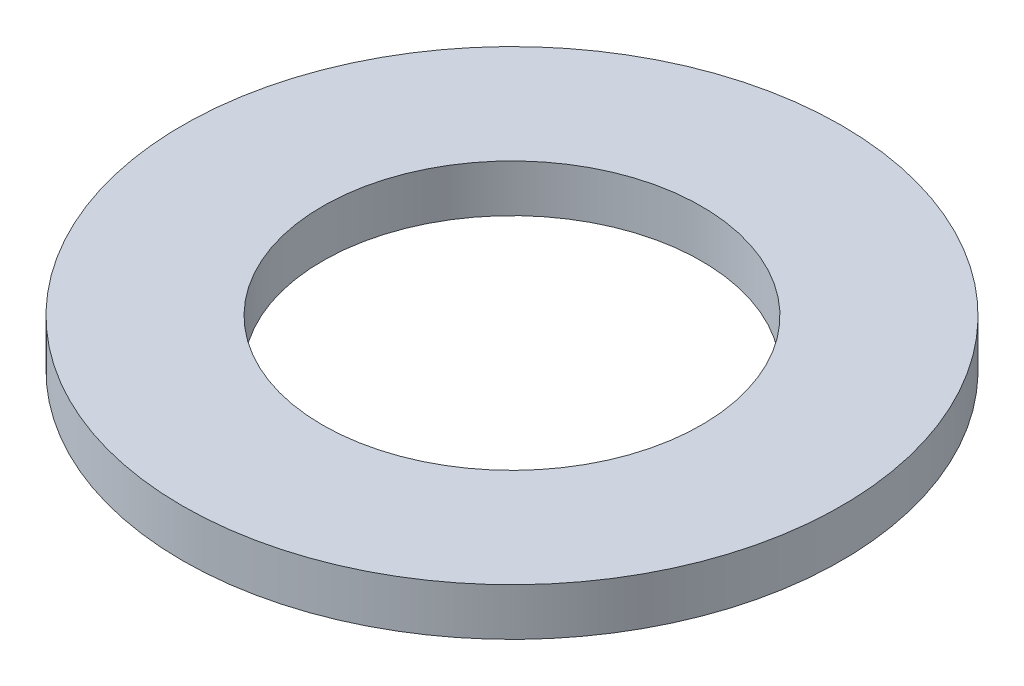
from build123d import *

# Parameters (mm, degrees)
SKETCH_1_R      = 8
SKETCH_1_R_2    = 4.6
EXTRUDE_1_DEPTH = 1.15


with BuildPart() as part:
    # 草图1 → 凸台-拉伸1 (new body)
    with BuildSketch(Plane(origin=(0, 0, 0), x_dir=(1, 0, 0), z_dir=(0, 1, 0))):
        with Locations(Location((0, 0, 0), (0, 0, 270))):
            Circle(SKETCH_1_R)
        with Locations(Location((0, 0, 0), (0, 0, 270))):
            Circle(SKETCH_1_R_2, mode=Mode.SUBTRACT)
    extrude(amount=EXTRUDE_1_DEPTH)


solid = part.part
